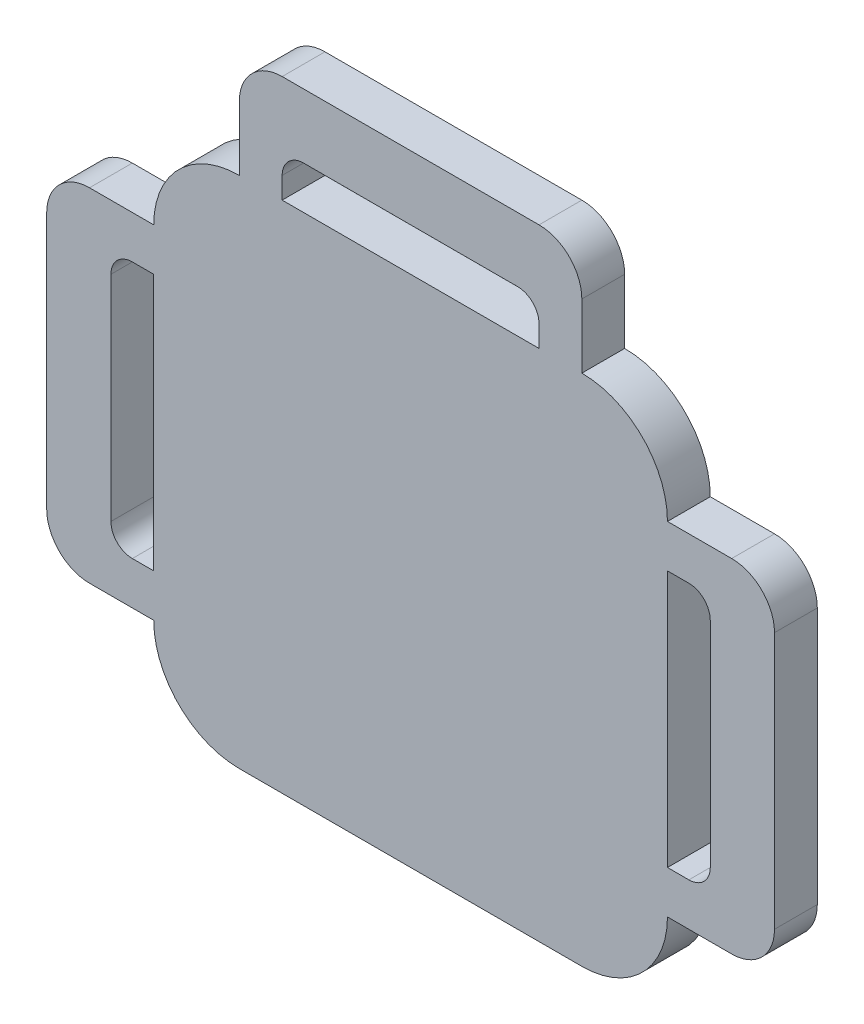
from build123d import *

# Parameters (mm, degrees)
SKETCH1_W           = 5
SKETCH1_H           = 30
SKETCH1_W_2         = 30
SKETCH1_H_2         = 5.002209569
BOSS_EXTRUDE2_DEPTH = 5
FILLET1_R           = 5
FILLET2_R           = 2.5


with BuildPart() as part:
    # Sketch1 → Boss-Extrude2 (new body)
    with BuildSketch(Plane.XY):
        with BuildLine():
            Line((-77.831835846, -13.494171848), (-37.831835846, -13.494171848))
            ThreePointArc((-37.831835846, -13.494171848), (-30.760768034, -10.56523966), (-27.831835846, -3.494171848))
            Line((-27.831835846, -3.494171848), (-15.331835846, -3.494171848))
            Line((-15.331835846, -3.494171848), (-15.331835846, 36.505828152))
            Line((-15.331835846, 36.505828152), (-27.831835846, 36.505828152))
            ThreePointArc((-27.831835846, 36.505828152), (-30.760768034, 43.576895964), (-37.831835846, 46.505828152))
            Line((-37.831835846, 46.505828152), (-37.831835846, 59.005828152))
            Line((-37.831835846, 59.005828152), (-77.831835846, 59.005828152))
            Line((-77.831835846, 59.005828152), (-77.831835846, 46.505828152))
            ThreePointArc((-77.831835846, 46.505828152), (-84.902903658, 43.576895964), (-87.831835846, 36.505828152))
            Line((-87.831835846, 36.505828152), (-100.331835846, 36.505828152))
            Line((-100.331835846, 36.505828152), (-100.331835846, -3.494171848))
            Line((-100.331835846, -3.494171848), (-87.831835846, -3.494171848))
            ThreePointArc((-87.831835846, -3.494171848), (-84.902903658, -10.56523966), (-77.831835846, -13.494171848))
        make_face()
        with Locations((-90.331835846, 16.505828152)):
            Rectangle(SKETCH1_W, SKETCH1_H, mode=Mode.SUBTRACT)
        with Locations((-57.831835846, 49.006932937)):
            Rectangle(SKETCH1_W_2, SKETCH1_H_2, mode=Mode.SUBTRACT)
        with Locations((-25.331835846, 16.505828152)):
            Rectangle(SKETCH1_W, SKETCH1_H, mode=Mode.SUBTRACT)
    extrude(amount=BOSS_EXTRUDE2_DEPTH)

    # Fillet1
    fillet1_edges = [part.edges().sort_by_distance(p)[0] for p in [
        (-15.331835846, 36.505828152, 2.5),
        (-15.331835846, -3.494171848, 2.5),
        (-100.331835846, -3.494171848, 2.5),
        (-100.331835846, 36.505828152, 2.5),
        (-77.831835846, 59.005828152, 2.5),
        (-37.831835846, 59.005828152, 2.5),
    ]]
    fillet(fillet1_edges, radius=FILLET1_R)

    # Fillet2
    fillet2_edges = [part.edges().sort_by_distance(p)[0] for p in [
        (-22.831835846, 31.505828152, 2.5),
        (-22.831835846, 1.505828152, 2.5),
        (-92.831835846, 31.505828152, 2.5),
        (-92.831835846, 1.505828152, 2.5),
        (-72.831835846, 51.508037721, 2.5),
        (-42.831835846, 51.508037721, 2.5),
    ]]
    fillet(fillet2_edges, radius=FILLET2_R)


solid = part.part
